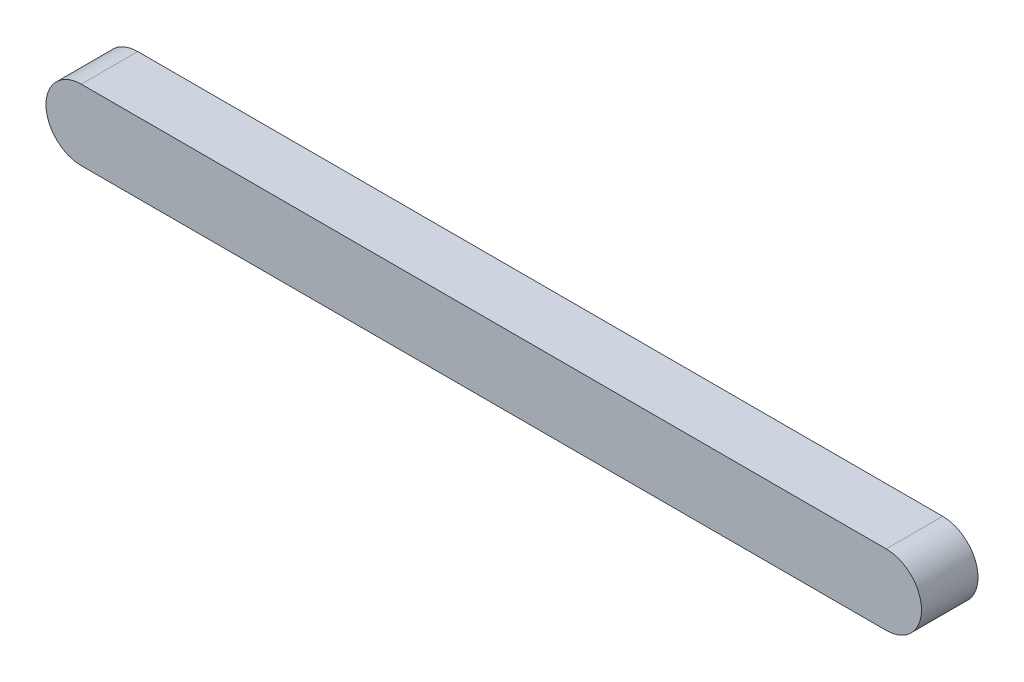
from build123d import *

# Parameters (mm, degrees)
EXTRUDE_3_DEPTH = 8


with BuildPart() as part:
    # Эскиз1 → Бобышка-Вытянуть3 (new body)
    with BuildSketch(Plane.XY):
        with BuildLine():
            Line((0, 5), (114, 5))
            ThreePointArc((114, 5), (119, 0), (114, -5))
            Line((114, -5), (0, -5))
            ThreePointArc((0, -5), (-5, 0), (0, 5))
        make_face()
    extrude(amount=EXTRUDE_3_DEPTH)


solid = part.part
